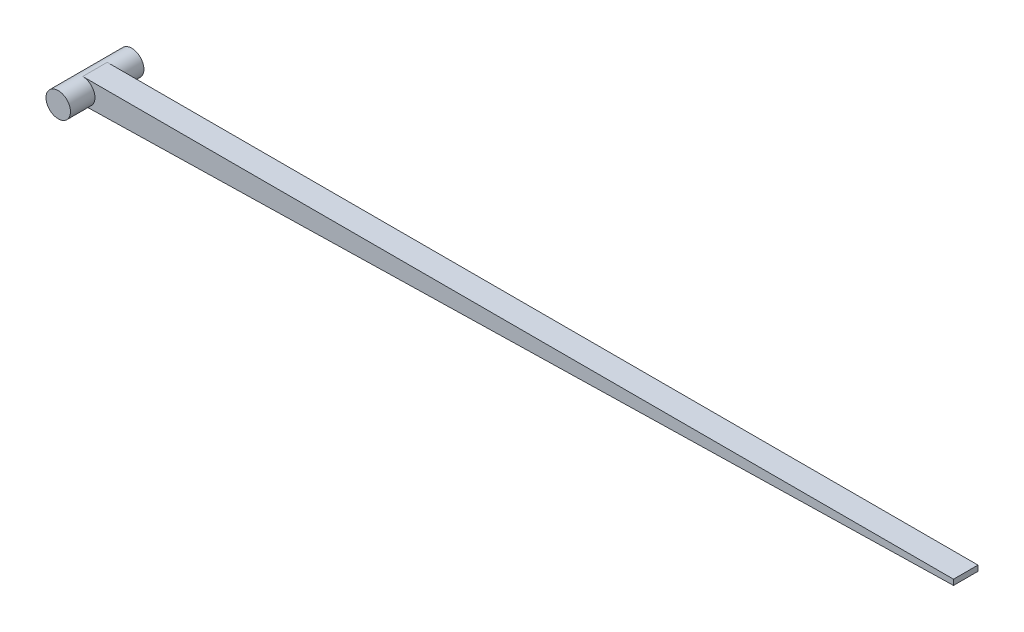
from build123d import *

# Parameters (mm, degrees)
BOSS_EXTRUDE1_DEPTH      = 45
BOSS_EXTRUDE2_DEPTH      = 45
BOSS_EXTRUDE2_DEPTH_BACK = 90
SKETCH2_R                = 22.5


with BuildPart() as part:
    # Sketch1 → Boss-Extrude1 (new body)
    with BuildSketch(Plane.XY):
        Polygon((0, 0), (1600, 0), (1600, -10), (0, -45), align=None)
    extrude(amount=BOSS_EXTRUDE1_DEPTH)

    # Sketch2 → Boss-Extrude2 (add, two sides: drawn at the far end of the back side and taken through both)
    with BuildSketch(Plane.XY.offset(45).offset(-BOSS_EXTRUDE2_DEPTH_BACK)):
        with Locations((0, -22.5)):
            Circle(SKETCH2_R)
    extrude(amount=BOSS_EXTRUDE2_DEPTH + BOSS_EXTRUDE2_DEPTH_BACK)


solid = part.part
